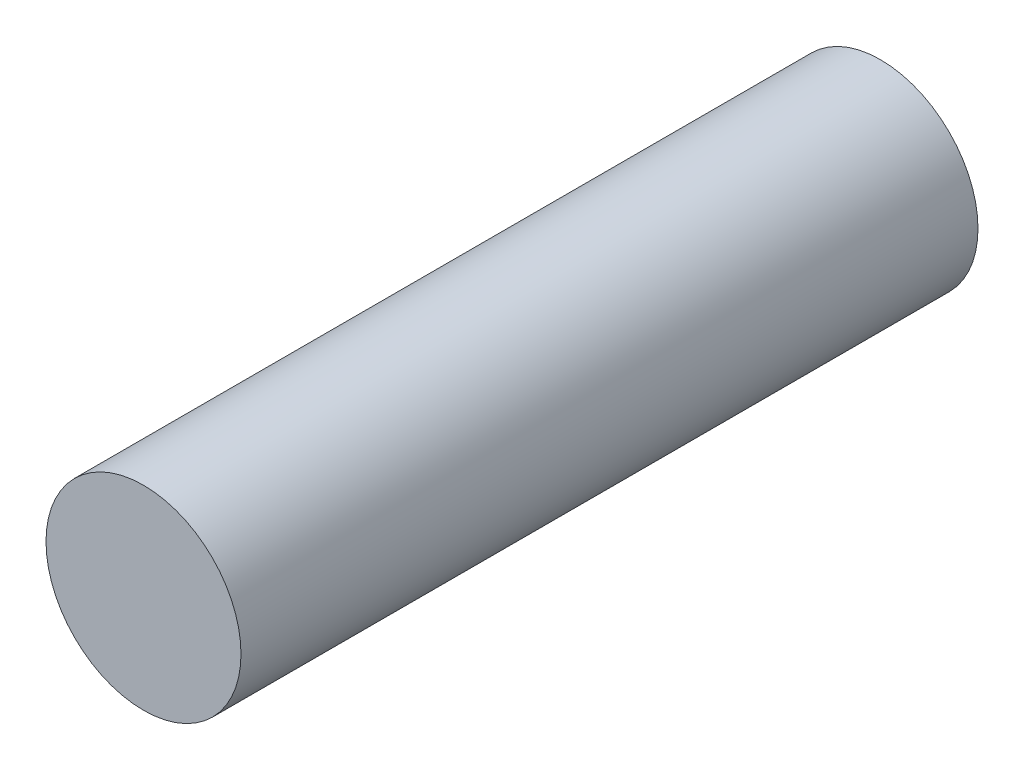
from build123d import *

# Parameters (mm, degrees)
CROQUIS1_R              = 3.175
SALIENTE_EXTRUIR1_DEPTH = 12


with BuildPart() as part:
    # Croquis1 → Saliente-Extruir1 (new, symmetric)
    with BuildSketch(Plane.XY):
        Circle(CROQUIS1_R)
    extrude(amount=SALIENTE_EXTRUIR1_DEPTH, both=True)


solid = part.part
